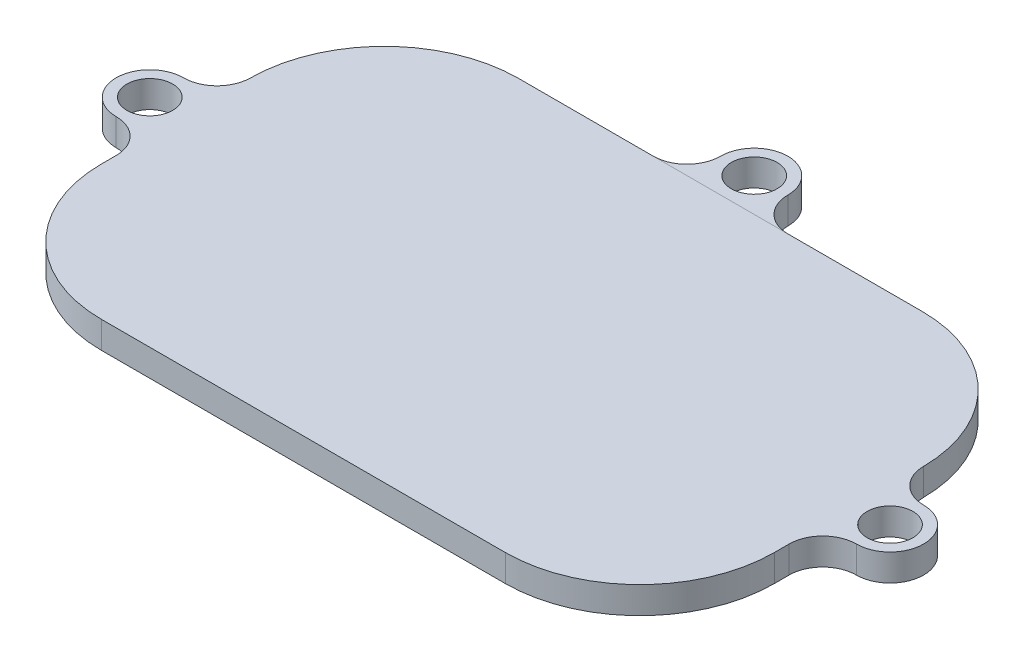
from build123d import *

# Parameters (mm, degrees)
SKETCH_1_W                  = 50
SKETCH_1_H                  = 31
EXTRUDE_1_DEPTH             = 2
EXTRUDE_2_DEPTH             = 2
EXTRUDE_3_DEPTH             = 2
SKETCH_5_W                  = 1.7
SKETCH_5_H                  = 2
HOLE_WIZARD_M3_1_AT_2_COUNT = 2
HOLE_WIZARD_M3_1_AT_2_PITCH = 32.547968148
HOLE_WIZARD_M3_1_AT_3_COUNT = 2
HOLE_WIZARD_M3_1_AT_3_PITCH = 32.547968148
FILLET_1_R                  = 10


with BuildPart() as part:
    # 草图1 → 凸台-拉伸1 (new body)
    with BuildSketch(Plane(origin=(0, 0, 0), x_dir=(1, 0, 0), z_dir=(0, 1, 0))):
        Rectangle(SKETCH_1_W, SKETCH_1_H)
    extrude(amount=EXTRUDE_1_DEPTH)

    # 草图6 → 凸台-拉伸3 (add)
    with BuildSketch(Plane(origin=(0, 2, 0), x_dir=(1, 0, 0), z_dir=(0, 1, 0))):
        with BuildLine():
            Line((-25, 5.589651624), (-25, -4.410348376))
            ThreePointArc((-25, -4.410348376), (-25.732233047, -2.642581423), (-27.5, -1.910348376))
            ThreePointArc((-27.5, -1.910348376), (-30, 0.589651624), (-27.5, 3.089651624))
            ThreePointArc((-27.5, 3.089651624), (-25.732233047, 3.821884671), (-25, 5.589651624))
        make_face()
        with BuildLine():
            Line((25, 5.589651624), (25, -4.410348376))
            ThreePointArc((25, -4.410348376), (25.732233047, -2.642581423), (27.5, -1.910348376))
            ThreePointArc((27.5, -1.910348376), (30, 0.589651624), (27.5, 3.089651624))
            ThreePointArc((27.5, 3.089651624), (25.732233047, 3.821884671), (25, 5.589651624))
        make_face()
    extrude(amount=-EXTRUDE_3_DEPTH)


with BuildPart() as body_2:
    # 草图2 → 凸台-拉伸2 (new body)
    with BuildSketch(Plane(origin=(0, 2, 0), x_dir=(1, 0, 0), z_dir=(0, 1, 0))):
        with BuildLine():
            Line((-5, 15.5), (5, 15.5))
            ThreePointArc((5, 15.5), (3.232233047, 16.232233047), (2.5, 18))
            ThreePointArc((2.5, 18), (0, 20.5), (-2.5, 18))
            ThreePointArc((-2.5, 18), (-3.232233047, 16.232233047), (-5, 15.5))
        make_face()
    extrude(amount=-EXTRUDE_2_DEPTH)

    # 草图5 → M3 间隙孔1 (revolve, cut)
    with BuildSketch(Plane(origin=(0, 2, -18), x_dir=(0, 0, 1), z_dir=(1, 0, 0))):
        with Locations((0.85, 1)):
            Rectangle(SKETCH_5_W, SKETCH_5_H)
    hole_wizard_m3_1 = revolve(axis=Axis((0, 8.35, -18), (0, -1, 0)), mode=Mode.SUBTRACT)


with BuildPart() as part_1:
    add(part.part)

    # M3 间隙孔1 at 2: M3 间隙孔1 ×2
    with Locations(*[Vector(-0.8449068118474433, 0, 0.5349135250615646) * (i * HOLE_WIZARD_M3_1_AT_2_PITCH) for i in range(1, HOLE_WIZARD_M3_1_AT_2_COUNT)]):
        add(hole_wizard_m3_1, mode=Mode.SUBTRACT)

    # M3 间隙孔1 at 3: M3 间隙孔1 ×2
    with Locations(*[Vector(0.8449068118474434, 0, 0.5349135250615644) * (i * HOLE_WIZARD_M3_1_AT_3_PITCH) for i in range(1, HOLE_WIZARD_M3_1_AT_3_COUNT)]):
        add(hole_wizard_m3_1, mode=Mode.SUBTRACT)

    # 圆角1
    fillet_1_edges = [part_1.edges().sort_by_distance(p)[0] for p in [
        (25, 1, -15.5),
        (-25, 1, -15.5),
        (25, 1, 15.5),
        (-25, 1, 15.5),
    ]]
    fillet(fillet_1_edges, radius=FILLET_1_R)


solid = Compound([body_2.part, part_1.part])
